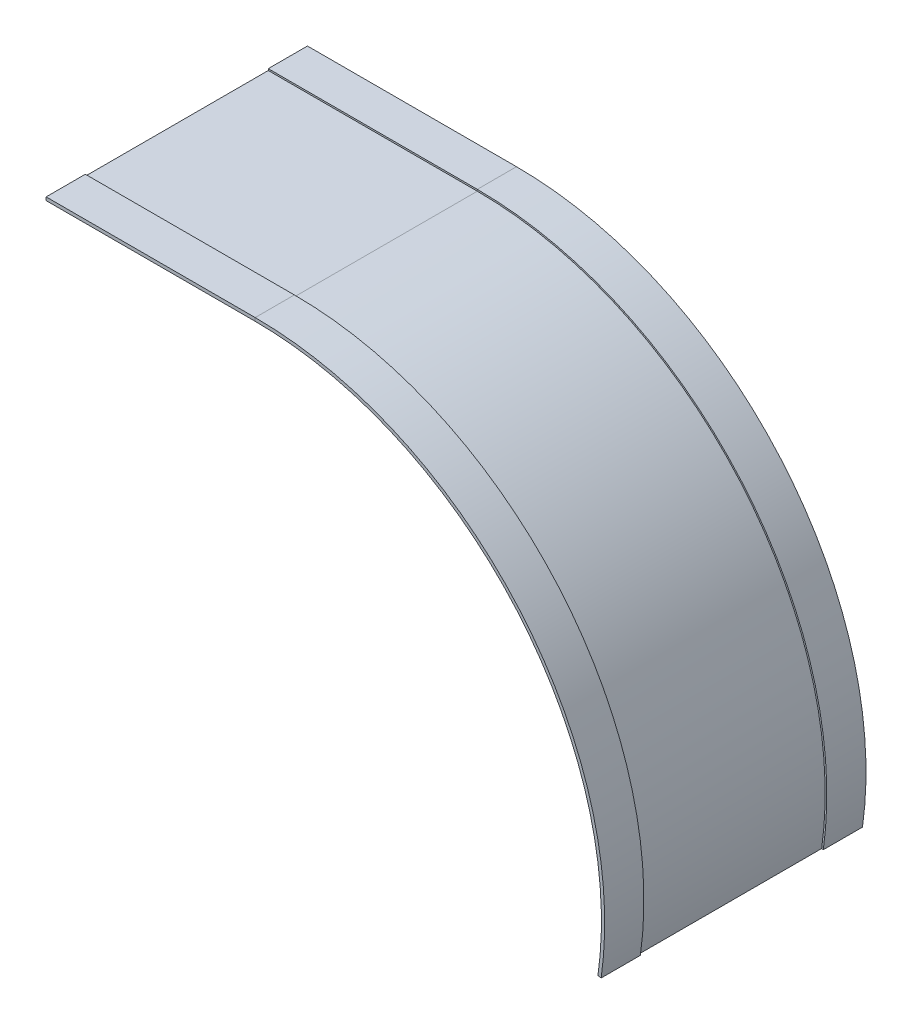
from build123d import *


with BuildPart() as part:
    # Sweep1: sweep along a path in Sketch2
    with BuildLine(Plane.XY) as sweep1_path:
        Line((-101.6, 160.067645398), (0, 160.067645398))
        ThreePointArc((0, 160.067645398), (127.128918942, 102.041063045), (166.581633047, -32.019854602))
    # Sketch3 → Sweep1 (sweep)
    with BuildSketch(Plane(origin=(-101.6, 0, 0), x_dir=(0, 0, -1), z_dir=(1, 0, 0))):
        Polygon((63.5, 160.067645398), (-63.5, 160.067645398), (-63.5, 161.655145398), (-44.45, 161.655145398), (-44.45, 160.861395398), (44.45, 160.861395398), (44.45, 161.655145398), (63.5, 161.655145398), align=None)
    sweep(path=sweep1_path.line)


solid = part.part
